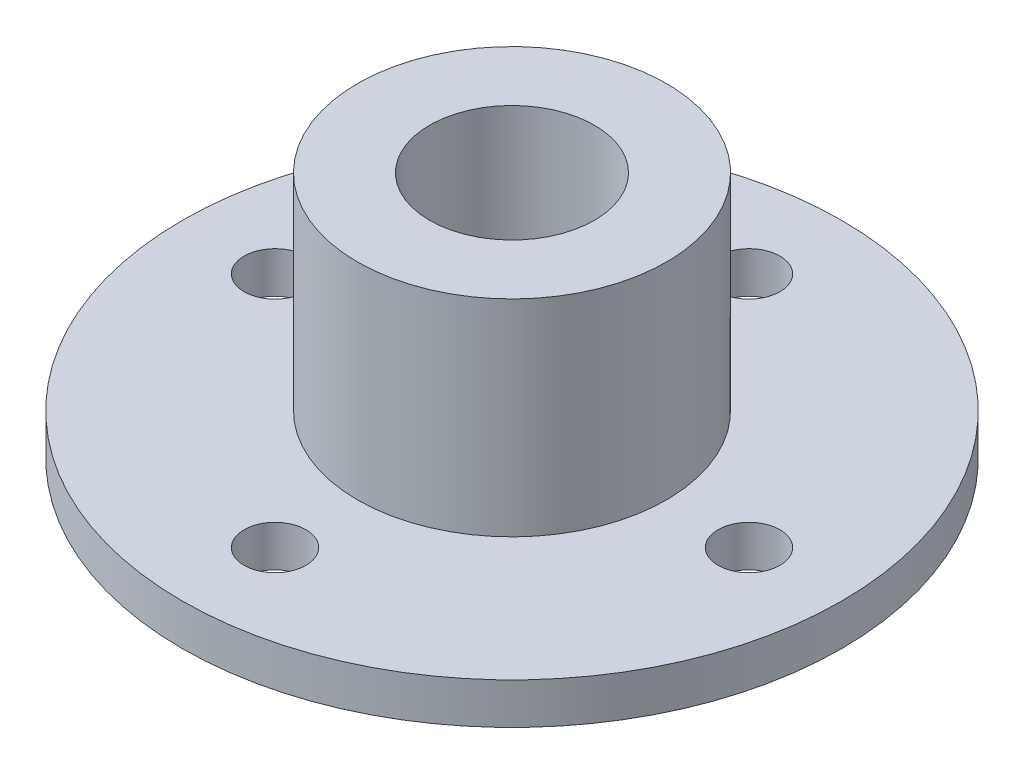
from build123d import *

# Parameters (mm, degrees)
SKETCH_1_R          = 16
EXTRUDE_1_DEPTH     = 2
SKETCH_2_R          = 7.5
SKETCH_2_R_2        = 4
EXTRUDE_2_DEPTH     = 10
SKETCH_3_R          = 1.5
CUT_EXTRUDE_1_DEPTH = 10


with BuildPart() as part:
    # 草图1 → 凸台-拉伸1 (new body)
    with BuildSketch(Plane(origin=(0, 0, 0), x_dir=(1, 0, 0), z_dir=(0, 1, 0))):
        with Locations(Location((0, 0, 0), (0, 0, 270))):
            Circle(SKETCH_1_R)
    extrude(amount=EXTRUDE_1_DEPTH)

    # 草图2 → 凸台-拉伸2 (add)
    with BuildSketch(Plane(origin=(0, 2, 0), x_dir=(1, 0, 0), z_dir=(0, 1, 0))):
        with Locations(Location((0, 0, 0), (0, 0, 270))):
            Circle(SKETCH_2_R)
        with Locations(Location((0, 0, 0), (0, 0, 270))):
            Circle(SKETCH_2_R_2, mode=Mode.SUBTRACT)
    extrude(amount=EXTRUDE_2_DEPTH)

    # 草图3 → 切除-拉伸1 (cut)
    with BuildSketch(Plane(origin=(0, 2, 0), x_dir=(1, 0, 0), z_dir=(0, 1, 0))):
        with Locations(Location((-11.5, 0, 0), (0, 0, 270))):
            Circle(SKETCH_3_R)
        with Locations(Location((0, 11.5, 0), (0, 0, 270))):
            Circle(SKETCH_3_R)
        with Locations(Location((11.5, 0, 0), (0, 0, 270))):
            Circle(SKETCH_3_R)
        with Locations(Location((0, -11.5, 0), (0, 0, 270))):
            Circle(SKETCH_3_R)
    extrude(amount=-CUT_EXTRUDE_1_DEPTH, mode=Mode.SUBTRACT)


solid = part.part
